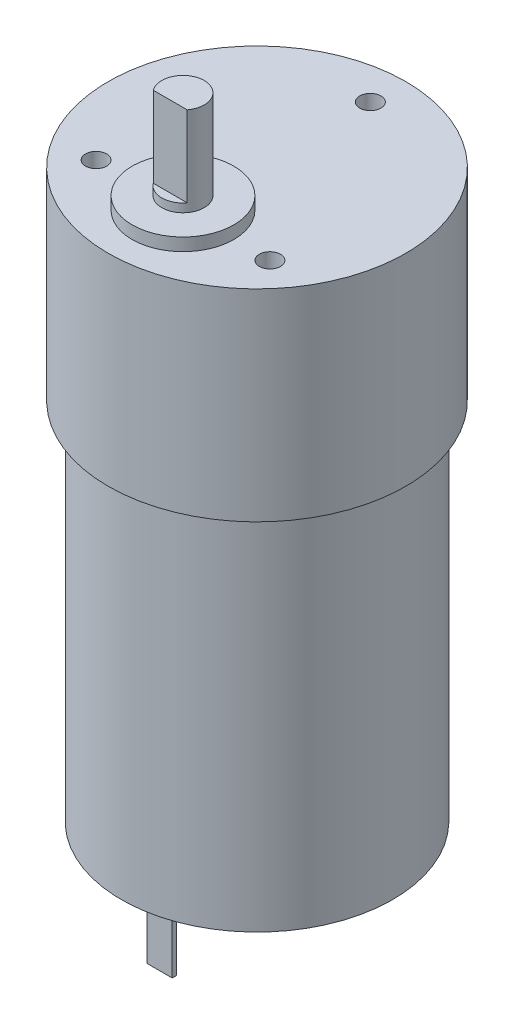
from build123d import *

# Parameters (mm, degrees)
ESQUISSE2_R             = 6
BOSS_EXTRU_1_DEPTH      = 1.5
ESQUISSE3_R             = 2.5
BOSS_EXTRU_2_DEPTH      = 10.5
TROU_TARAUD_M31_D       = 2.5
TROU_TARAUD_M31_DEPTH   = 4.5
TROU_TARAUD_M31_TIP     = 0.751075774
ESQUISSE7_W             = 4
ESQUISSE7_H             = 1.800245102
ENL_V_MAT_EXTRU_1_DEPTH = 9.5
ESQUISSE8_W             = 3
ESQUISSE8_H             = 0.5
BOSS_EXTRU_3_DEPTH      = 9.5


with BuildPart() as part:
    # Esquisse1 → Révolution1 (revolve)
    with BuildSketch(Plane.XY):
        Polygon((16, 0.5), (4, 0.5), (4, 0), (0, 0), (0, 67.3), (17.55, 67.3), (17.55, 43.5), (16, 43.5), align=None)
    revolve(axis=Axis((0, 0, 0), (0, 1, 0)))

    # Esquisse2 → Boss.-Extru.1 (add)
    with BuildSketch(Plane(origin=(0, 67.3, 0), x_dir=(1, 0, 0), z_dir=(0, 1, 0))):
        with Locations((0, -8.73)):
            Circle(ESQUISSE2_R)
    extrude(amount=BOSS_EXTRU_1_DEPTH)

    # Esquisse3 → Boss.-Extru.2 (add)
    with BuildSketch(Plane(origin=(0, 68.8, 0), x_dir=(1, 0, 0), z_dir=(0, 1, 0))):
        with Locations((0, -8.73)):
            Circle(ESQUISSE3_R)
    extrude(amount=BOSS_EXTRU_2_DEPTH)

    # Trou taraudé M31
    with Locations(Plane(origin=(0, 67.3, 0), x_dir=(1, 0, 0), z_dir=(0, 1, 0))):
        with Locations((0, 13.37), (10.25, -8.73), (-10.25, -8.73)):
            Hole(TROU_TARAUD_M31_D / 2, depth=TROU_TARAUD_M31_DEPTH)
            with Locations((0, 0, -(TROU_TARAUD_M31_DEPTH + TROU_TARAUD_M31_TIP / 2))):  # 118° drill point
                Cone(0, TROU_TARAUD_M31_D / 2, TROU_TARAUD_M31_TIP, mode=Mode.SUBTRACT)

    # Esquisse7 → Enlèv. mat.-Extru.1 (cut)
    with BuildSketch(Plane(origin=(0, 79.3, 0), x_dir=(1, 0, 0), z_dir=(0, 1, 0))):
        with Locations((0, -11.130122551)):
            Rectangle(ESQUISSE7_W, ESQUISSE7_H)
    extrude(amount=-ENL_V_MAT_EXTRU_1_DEPTH, mode=Mode.SUBTRACT)

    # Esquisse8 → Boss.-Extru.3 (add)
    with BuildSketch(Plane.XZ.offset(-0.5)):
        with Locations((0, -11.25)):
            Rectangle(ESQUISSE8_W, ESQUISSE8_H)
        with Locations((0, 11.25)):
            Rectangle(ESQUISSE8_W, ESQUISSE8_H)
    extrude(amount=BOSS_EXTRU_3_DEPTH)


solid = part.part
